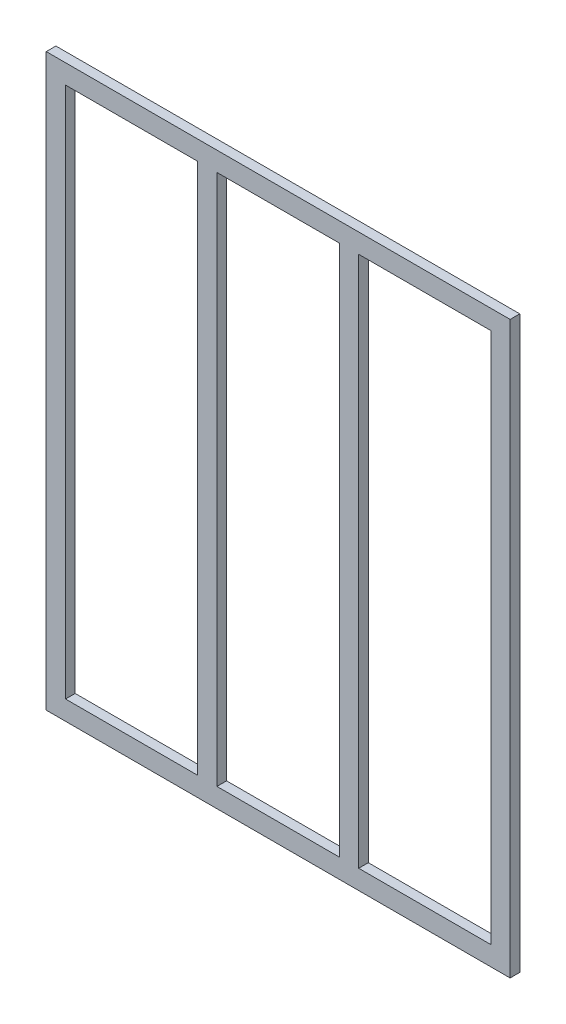
from build123d import *

# Parameters (mm, degrees)
CROQUIS1_W              = 1220
CROQUIS1_H              = 1500
CROQUIS1_W_2            = 1118.4
CROQUIS1_H_2            = 1398.4
SALIENTE_EXTRUIR1_DEPTH = 25.4
CROQUIS2_W              = 50.8
CROQUIS2_H              = 1398.4
SALIENTE_EXTRUIR2_DEPTH = 25.4


with BuildPart() as part:
    # Croquis1 → Saliente-Extruir1 (new body)
    with BuildSketch(Plane.XY):
        Rectangle(CROQUIS1_W, CROQUIS1_H)
        Rectangle(CROQUIS1_W_2, CROQUIS1_H_2, mode=Mode.SUBTRACT)
    extrude(amount=SALIENTE_EXTRUIR1_DEPTH)

    # Croquis2 → Saliente-Extruir2 (add)
    with BuildSketch(Plane.XY.offset(25.4)):
        with Locations((-186.4, 0)):
            Rectangle(CROQUIS2_W, CROQUIS2_H)
        with Locations((186.4, 0)):
            Rectangle(CROQUIS2_W, CROQUIS2_H)
    extrude(amount=-SALIENTE_EXTRUIR2_DEPTH)


solid = part.part
